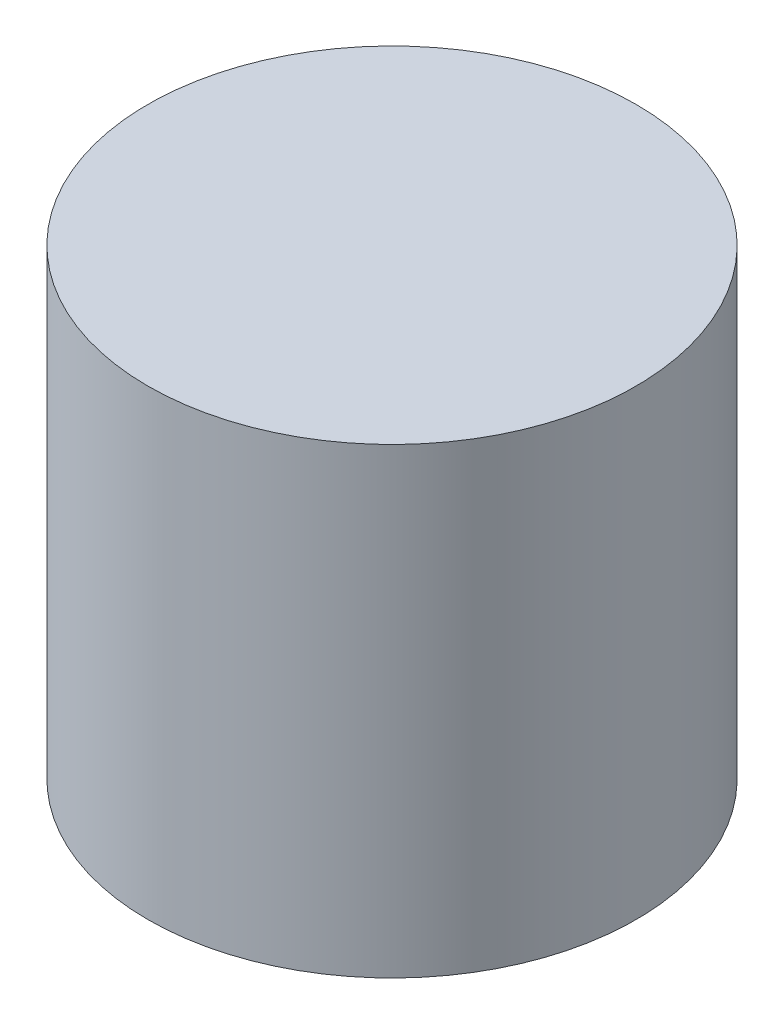
from build123d import *

# Parameters (mm, degrees)
SKETCH1_R           = 37.5
BOSS_EXTRUDE1_DEPTH = 71


with BuildPart() as part:
    # Sketch1 → Boss-Extrude1 (new body)
    with BuildSketch(Plane(origin=(0, 0, 0), x_dir=(1, 0, 0), z_dir=(0, 1, 0))):
        with Locations(Location((0, 0, 0), (0, 0, 270))):
            Circle(SKETCH1_R)
    extrude(amount=BOSS_EXTRUDE1_DEPTH)


solid = part.part
